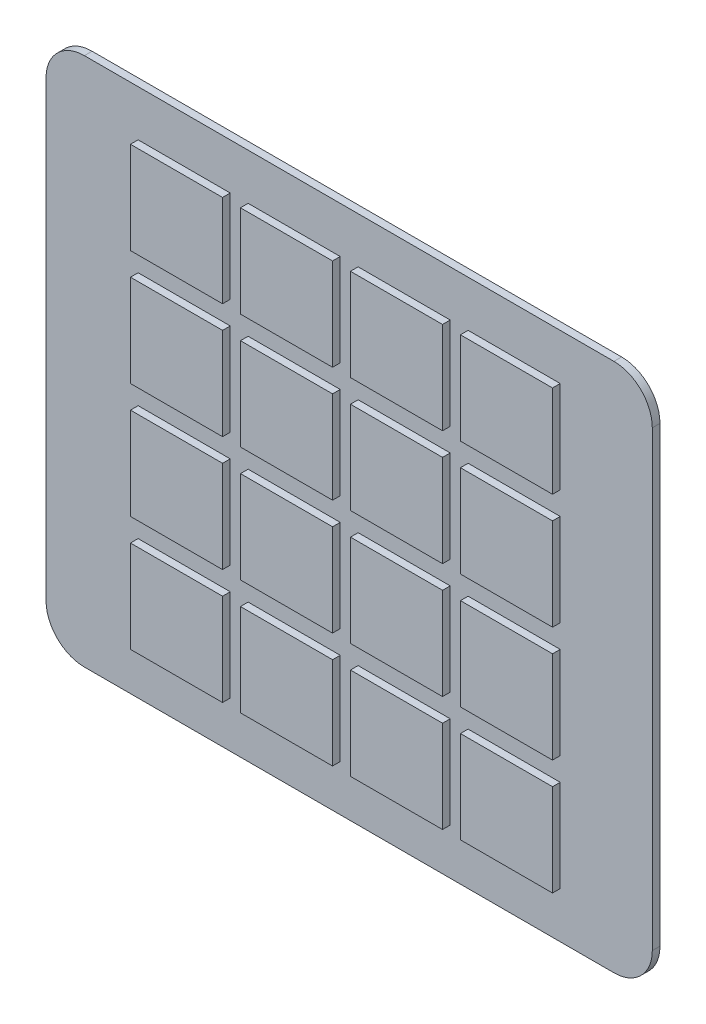
from build123d import *

# Parameters (mm, degrees)
BOSS_EXTRU_1_DEPTH = 0.1
ESQUISSE2_W        = 1.2
ESQUISSE2_H        = 1.2
BOSS_EXTRU_2_DEPTH = 0.1


with BuildPart() as part:
    # Esquisse1 → Boss.-Extru.1 (new body)
    with BuildSketch(Plane.XY):
        with BuildLine():
            Line((0, -0.5), (6.9, -0.5))
            ThreePointArc((6.9, -0.5), (7.253553391, -0.353553391), (7.4, 0))
            Line((7.4, 0), (7.4, 5.9))
            ThreePointArc((7.4, 5.9), (7.253553391, 6.253553391), (6.9, 6.4))
            Line((6.9, 6.4), (0, 6.4))
            ThreePointArc((0, 6.4), (-0.353553391, 6.253553391), (-0.5, 5.9))
            Line((-0.5, 5.9), (-0.5, 0))
            ThreePointArc((-0.5, 0), (-0.353553391, -0.353553391), (0, -0.5))
        make_face()
    extrude(amount=BOSS_EXTRU_1_DEPTH)

    # Esquisse2 → Boss.-Extru.2 (add)
    with BuildSketch(Plane.XY.offset(0.1)):
        with Locations((1.3, 0.7)):
            Rectangle(ESQUISSE2_W, ESQUISSE2_H)
        with Locations((2.733333333, 0.7)):
            Rectangle(ESQUISSE2_W, ESQUISSE2_H)
        with Locations((4.166666667, 0.7)):
            Rectangle(ESQUISSE2_W, ESQUISSE2_H)
        with Locations((5.6, 0.7)):
            Rectangle(ESQUISSE2_W, ESQUISSE2_H)
        with Locations((2.733333333, 2.2)):
            Rectangle(ESQUISSE2_W, ESQUISSE2_H)
        with Locations((4.166666667, 2.2)):
            Rectangle(ESQUISSE2_W, ESQUISSE2_H)
        with Locations((5.6, 2.2)):
            Rectangle(ESQUISSE2_W, ESQUISSE2_H)
        with Locations((2.733333333, 3.7)):
            Rectangle(ESQUISSE2_W, ESQUISSE2_H)
        with Locations((4.166666667, 3.7)):
            Rectangle(ESQUISSE2_W, ESQUISSE2_H)
        with Locations((5.6, 3.7)):
            Rectangle(ESQUISSE2_W, ESQUISSE2_H)
        with Locations((2.733333333, 5.2)):
            Rectangle(ESQUISSE2_W, ESQUISSE2_H)
        with Locations((4.166666667, 5.2)):
            Rectangle(ESQUISSE2_W, ESQUISSE2_H)
        with Locations((5.6, 5.2)):
            Rectangle(ESQUISSE2_W, ESQUISSE2_H)
        with Locations((1.3, 2.2)):
            Rectangle(ESQUISSE2_W, ESQUISSE2_H)
        with Locations((1.3, 3.7)):
            Rectangle(ESQUISSE2_W, ESQUISSE2_H)
        with Locations((1.3, 5.2)):
            Rectangle(ESQUISSE2_W, ESQUISSE2_H)
    extrude(amount=BOSS_EXTRU_2_DEPTH)


solid = part.part
